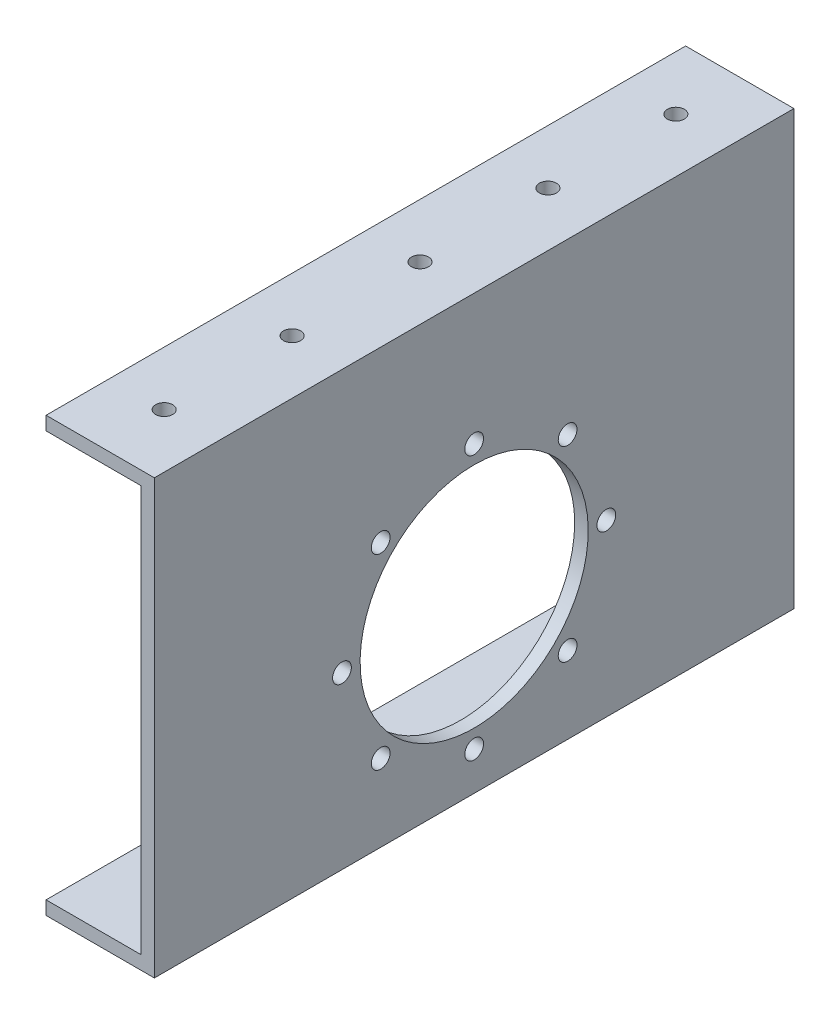
from build123d import *

# Parameters (mm, degrees)
BOSS_EXTRUDE1_DEPTH = 150
SKETCH2_R           = 26.75
SKETCH2_R_2         = 2.2
CUT_EXTRUDE1_DEPTH  = 3.175
CUT_EXTRUDE2_REACH  = 184.942
SKETCH3_R           = 2


with BuildPart() as part:
    # Sketch1 → Boss-Extrude1 (new body)
    with BuildSketch(Plane.XY):
        Polygon((0, 78.463366337), (25.4, 78.463366337), (25.4, -23.136633663), (0, -23.136633663), (0, -19.961633663), (22.225, -19.961633663), (22.225, 75.288366337), (0, 75.288366337), align=None)
    extrude(amount=BOSS_EXTRUDE1_DEPTH)

    # Sketch2 → Cut-Extrude1 (cut)
    with BuildSketch(Plane(origin=(25.4, 0, 0), x_dir=(0, 0, -1), z_dir=(1, 0, 0))):
        with Locations(Location((-75, 16.863366337, 0), (0, 0, 90))):
            Circle(SKETCH2_R)
        with Locations(Location((-75, 47.863366337, 0), (0, 0, 90))):
            Circle(SKETCH2_R_2)
        with Locations(Location((-53.079689783, 38.783676553, 0), (0, 0, 90))):
            Circle(SKETCH2_R_2)
        with Locations(Location((-44, 16.863366337, 0), (0, 0, 90))):
            Circle(SKETCH2_R_2)
        with Locations(Location((-53.079689783, -5.05694388, 0), (0, 0, 90))):
            Circle(SKETCH2_R_2)
        with Locations(Location((-75, -14.136633663, 0), (0, 0, 90))):
            Circle(SKETCH2_R_2)
        with Locations(Location((-96.920310217, -5.05694388, 0), (0, 0, 90))):
            Circle(SKETCH2_R_2)
        with Locations(Location((-106, 16.863366337, 0), (0, 0, 90))):
            Circle(SKETCH2_R_2)
        with Locations(Location((-96.920310217, 38.783676553, 0), (0, 0, 90))):
            Circle(SKETCH2_R_2)
    extrude(amount=-CUT_EXTRUDE1_DEPTH, mode=Mode.SUBTRACT)

    # Cut-Extrude2: up to this face of the body (flat: up to its plane)
    cut_extrude2_end = Plane(part.part.faces().sort_by_distance((12.7, -23.136633663, 75))[0])
    # Sketch3 → Cut-Extrude2 (cut, up to the picked face)
    with BuildSketch(Plane(origin=(0, 78.463366337, 0), x_dir=(1, 0, 0), z_dir=(0, 1, 0)), mode=Mode.PRIVATE) as cut_extrude2_sk1:
        with Locations(Location((12.7, -75, 0), (0, 0, 270))):
            Circle(SKETCH3_R)
    cut_extrude2_tool1 = split(extrude(cut_extrude2_sk1.sketch, amount=-CUT_EXTRUDE2_REACH, mode=Mode.PRIVATE), bisect_by=cut_extrude2_end, keep=Keep.BOTH, mode=Mode.PRIVATE)
    # Sketch3 → Cut-Extrude2 (cut, up to the picked face)
    with BuildSketch(Plane(origin=(0, 78.463366337, 0), x_dir=(1, 0, 0), z_dir=(0, 1, 0)), mode=Mode.PRIVATE) as cut_extrude2_sk2:
        with Locations(Location((12.7, -105, 0), (0, 0, 270))):
            Circle(SKETCH3_R)
    cut_extrude2_tool2 = split(extrude(cut_extrude2_sk2.sketch, amount=-CUT_EXTRUDE2_REACH, mode=Mode.PRIVATE), bisect_by=cut_extrude2_end, keep=Keep.BOTH, mode=Mode.PRIVATE)
    # Sketch3 → Cut-Extrude2 (cut, up to the picked face)
    with BuildSketch(Plane(origin=(0, 78.463366337, 0), x_dir=(1, 0, 0), z_dir=(0, 1, 0)), mode=Mode.PRIVATE) as cut_extrude2_sk3:
        with Locations(Location((12.7, -135, 0), (0, 0, 270))):
            Circle(SKETCH3_R)
    cut_extrude2_tool3 = split(extrude(cut_extrude2_sk3.sketch, amount=-CUT_EXTRUDE2_REACH, mode=Mode.PRIVATE), bisect_by=cut_extrude2_end, keep=Keep.BOTH, mode=Mode.PRIVATE)
    # Sketch3 → Cut-Extrude2 (cut, up to the picked face)
    with BuildSketch(Plane(origin=(0, 78.463366337, 0), x_dir=(1, 0, 0), z_dir=(0, 1, 0)), mode=Mode.PRIVATE) as cut_extrude2_sk4:
        with Locations(Location((12.7, -45, 0), (0, 0, 270))):
            Circle(SKETCH3_R)
    cut_extrude2_tool4 = split(extrude(cut_extrude2_sk4.sketch, amount=-CUT_EXTRUDE2_REACH, mode=Mode.PRIVATE), bisect_by=cut_extrude2_end, keep=Keep.BOTH, mode=Mode.PRIVATE)
    # Sketch3 → Cut-Extrude2 (cut, up to the picked face)
    with BuildSketch(Plane(origin=(0, 78.463366337, 0), x_dir=(1, 0, 0), z_dir=(0, 1, 0)), mode=Mode.PRIVATE) as cut_extrude2_sk5:
        with Locations(Location((12.7, -15, 0), (0, 0, 270))):
            Circle(SKETCH3_R)
    cut_extrude2_tool5 = split(extrude(cut_extrude2_sk5.sketch, amount=-CUT_EXTRUDE2_REACH, mode=Mode.PRIVATE), bisect_by=cut_extrude2_end, keep=Keep.BOTH, mode=Mode.PRIVATE)
    add(cut_extrude2_tool1.solids().sort_by(Axis((12.7, 78.463366, 75), (0, -1, 0)))[0], mode=Mode.SUBTRACT)
    add(cut_extrude2_tool2.solids().sort_by(Axis((12.7, 78.463366, 105), (0, -1, 0)))[0], mode=Mode.SUBTRACT)
    add(cut_extrude2_tool3.solids().sort_by(Axis((12.7, 78.463366, 135), (0, -1, 0)))[0], mode=Mode.SUBTRACT)
    add(cut_extrude2_tool4.solids().sort_by(Axis((12.7, 78.463366, 45), (0, -1, 0)))[0], mode=Mode.SUBTRACT)
    add(cut_extrude2_tool5.solids().sort_by(Axis((12.7, 78.463366, 15), (0, -1, 0)))[0], mode=Mode.SUBTRACT)


solid = part.part
